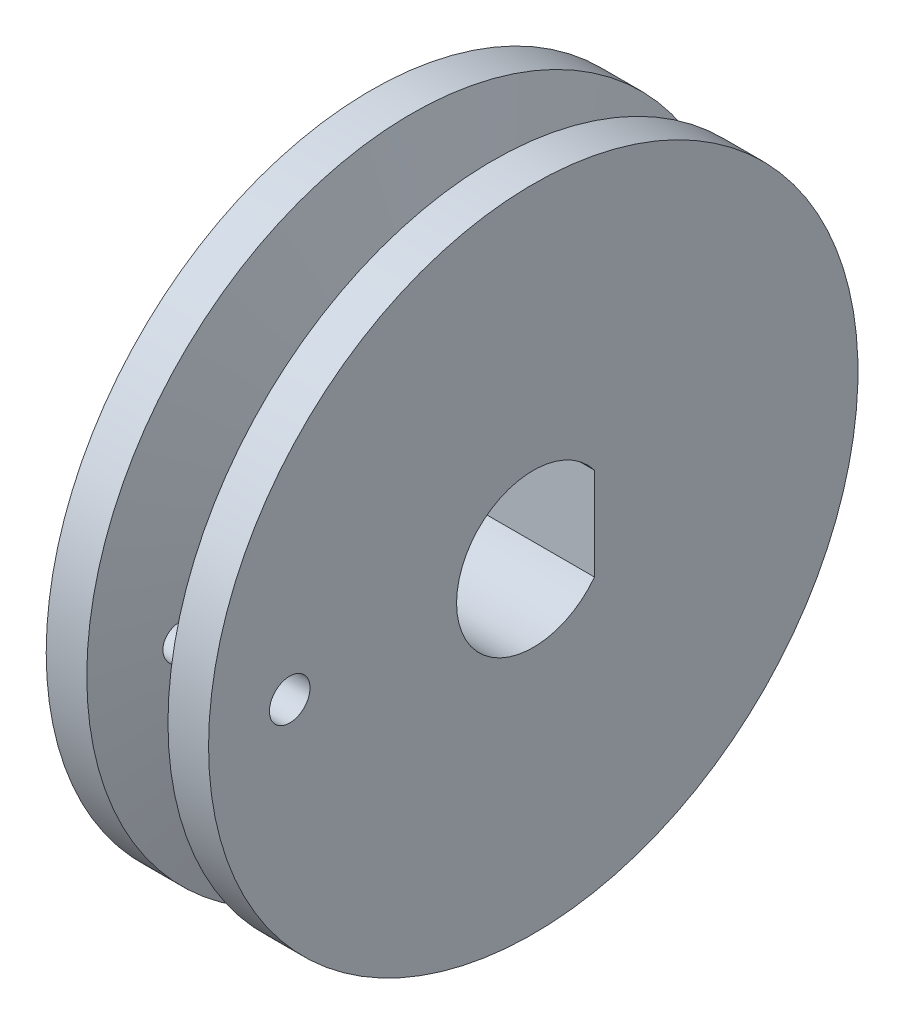
from build123d import *

# Parameters (mm, degrees)
CUT_EXTRUDE1_DEPTH      = 20.05
CUT_EXTRUDE1_DEPTH_BACK = 20.05
CUT_EXTRUDE2_DEPTH      = 20.05
CUT_EXTRUDE2_DEPTH_BACK = 20.05
SKETCH4_R               = 0.79375


with BuildPart() as part:
    # Sketch2 → Revolve1 (revolve)
    with BuildSketch(Plane.XY, mode=Mode.PRIVATE) as revolve1_sk:
        Polygon((0, 0), (0, 12.7), (1.5875, 12.7), (3.175, 6.35), (4.7625, 12.7), (6.35, 12.7), (6.35, 0), align=None)
    revolve(revolve1_sk.sketch.rotate(Axis((0, 0, 0), (1, 0, 0)), 90), axis=Axis((0, 0, 0), (1, 0, 0)))

    # Sketch3 → Cut-Extrude1 (cut, two sides: drawn at the far end of the back side and taken through both)
    with BuildSketch(Plane(origin=(6.35, 0, 0), x_dir=(0, 0, -1), z_dir=(1, 0, 0)).offset(-CUT_EXTRUDE1_DEPTH_BACK)):
        with BuildLine():
            Line((2.392934, -1.80937306), (2.392934, 1.80937306))
            ThreePointArc((2.392934, 1.80937306), (-2.999994, 0), (2.392934, -1.80937306))
        make_face()
    extrude(amount=CUT_EXTRUDE1_DEPTH + CUT_EXTRUDE1_DEPTH_BACK, mode=Mode.SUBTRACT)

    # Sketch4 → Cut-Extrude2 (cut, two sides: drawn at the far end of the back side and taken through both)
    with BuildSketch(Plane(origin=(6.35, 0, 0), x_dir=(0, 0, -1), z_dir=(1, 0, 0)).offset(-CUT_EXTRUDE2_DEPTH_BACK)):
        with Locations((-9.525, 0)):
            Circle(SKETCH4_R)
    extrude(amount=CUT_EXTRUDE2_DEPTH + CUT_EXTRUDE2_DEPTH_BACK, mode=Mode.SUBTRACT)


solid = part.part
